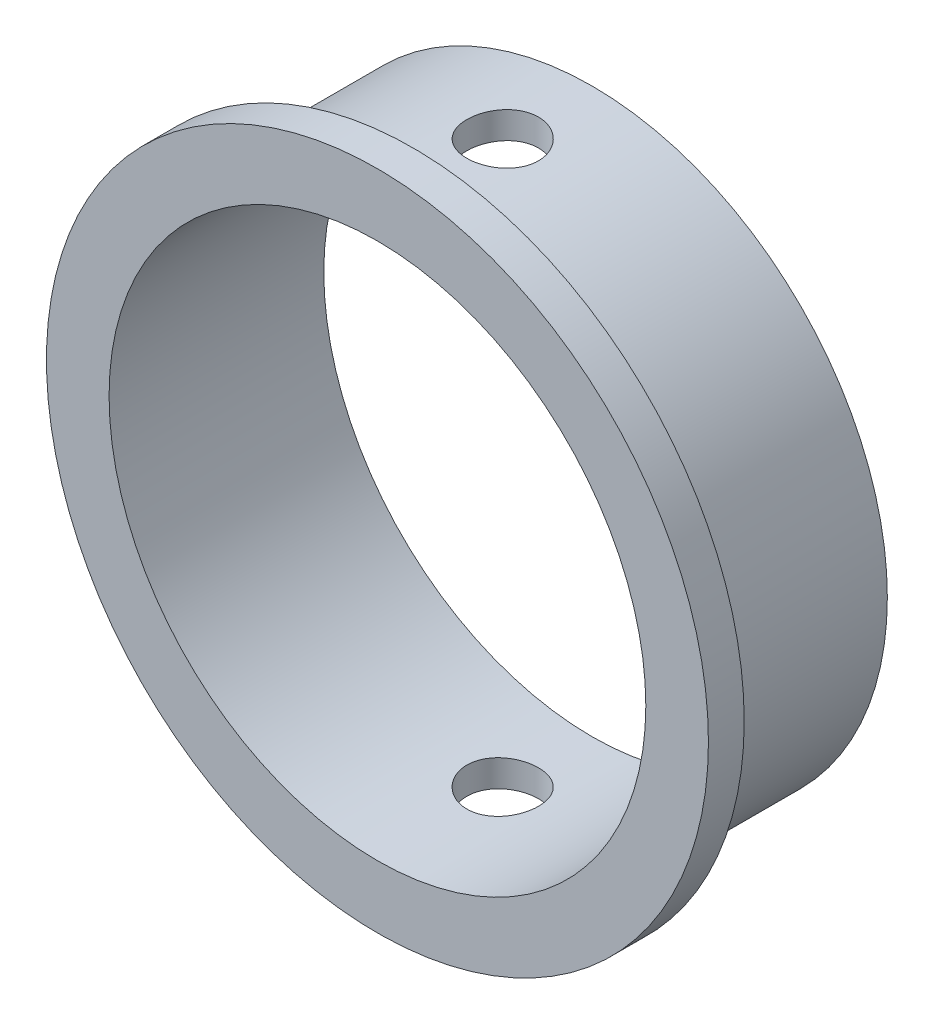
from build123d import *

# Parameters (mm, degrees)
CROQUIS2_R                 = 16.5
CROQUIS2_R_2               = 15
SALIENTE_EXTRUIR1_DEPTH    = 12
CROQUIS3_R                 = 18.5
SALIENTE_EXTRUIR2_DEPTH    = 2
CROQUIS4_R                 = 15
CORTAR_EXTRUIR1_DEPTH      = 2
CORTAR_EXTRUIR2_DEPTH      = 22
CORTAR_EXTRUIR2_DEPTH_BACK = 21
CROQUIS5_R                 = 2


with BuildPart() as part:
    # Croquis2 → Saliente-Extruir1 (new body)
    with BuildSketch(Plane.XY):
        Circle(CROQUIS2_R)
        Circle(CROQUIS2_R_2, mode=Mode.SUBTRACT)
    extrude(amount=SALIENTE_EXTRUIR1_DEPTH)

    # Croquis3 → Saliente-Extruir2 (add)
    with BuildSketch(Plane.XY.offset(12)):
        Circle(CROQUIS3_R)
    extrude(amount=-SALIENTE_EXTRUIR2_DEPTH)

    # Croquis4 → Cortar-Extruir1 (cut)
    with BuildSketch(Plane(origin=(0, 0, 10), x_dir=(-1, 0, 0), z_dir=(0, 0, -1))):
        Circle(CROQUIS4_R)
    extrude(amount=-CORTAR_EXTRUIR1_DEPTH, mode=Mode.SUBTRACT)

    # Croquis5 → Cortar-Extruir2 (cut, two sides: drawn at the far end of the back side and taken through both)
    with BuildSketch(Plane(origin=(0, 0, 0), x_dir=(1, 0, 0), z_dir=(0, 1, 0)).offset(-CORTAR_EXTRUIR2_DEPTH_BACK)):
        with Locations(Location((0, -5, 0), (0, 0, 90))):
            Circle(CROQUIS5_R)
    extrude(amount=CORTAR_EXTRUIR2_DEPTH + CORTAR_EXTRUIR2_DEPTH_BACK, mode=Mode.SUBTRACT)


solid = part.part
